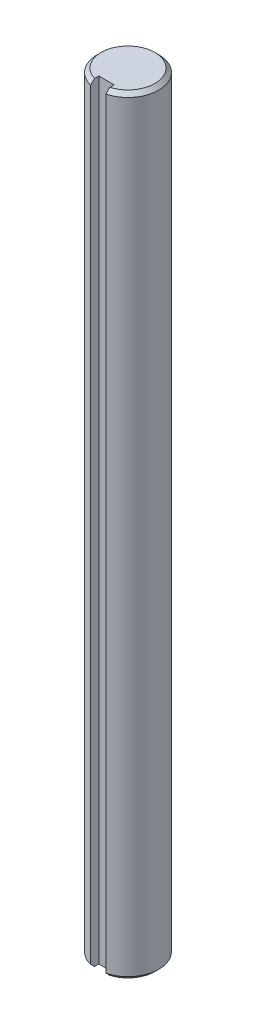
from build123d import *

# Parameters (mm, degrees)
SKETCH1_R           = 4
BOSS_EXTRUDE1_DEPTH = 100
SKETCH2_W           = 2
SKETCH2_H           = 2
CUT_EXTRUDE1_DEPTH  = 101.159872204
CHAMFER1_SIZE       = 0.5


with BuildPart() as part:
    # Sketch1 → Boss-Extrude1 (new body)
    with BuildSketch(Plane(origin=(0, 0, 0), x_dir=(1, 0, 0), z_dir=(0, 1, 0))):
        with Locations(Location((0, 0, 0), (0, 0, 270))):
            Circle(SKETCH1_R)
    extrude(amount=BOSS_EXTRUDE1_DEPTH)

    # Sketch2 → Cut-Extrude1 (cut, through all)
    with BuildSketch(Plane.XZ):
        with Locations((0, 3.8)):
            Rectangle(SKETCH2_W, SKETCH2_H)
    extrude(amount=-CUT_EXTRUDE1_DEPTH, mode=Mode.SUBTRACT)

    # Chamfer1
    chamfer1_edges = [part.edges().sort_by_distance(p)[0] for p in [
        (0, 0, -4),
        (0, 100, -4),
    ]]
    chamfer(chamfer1_edges, length=CHAMFER1_SIZE)


solid = part.part
